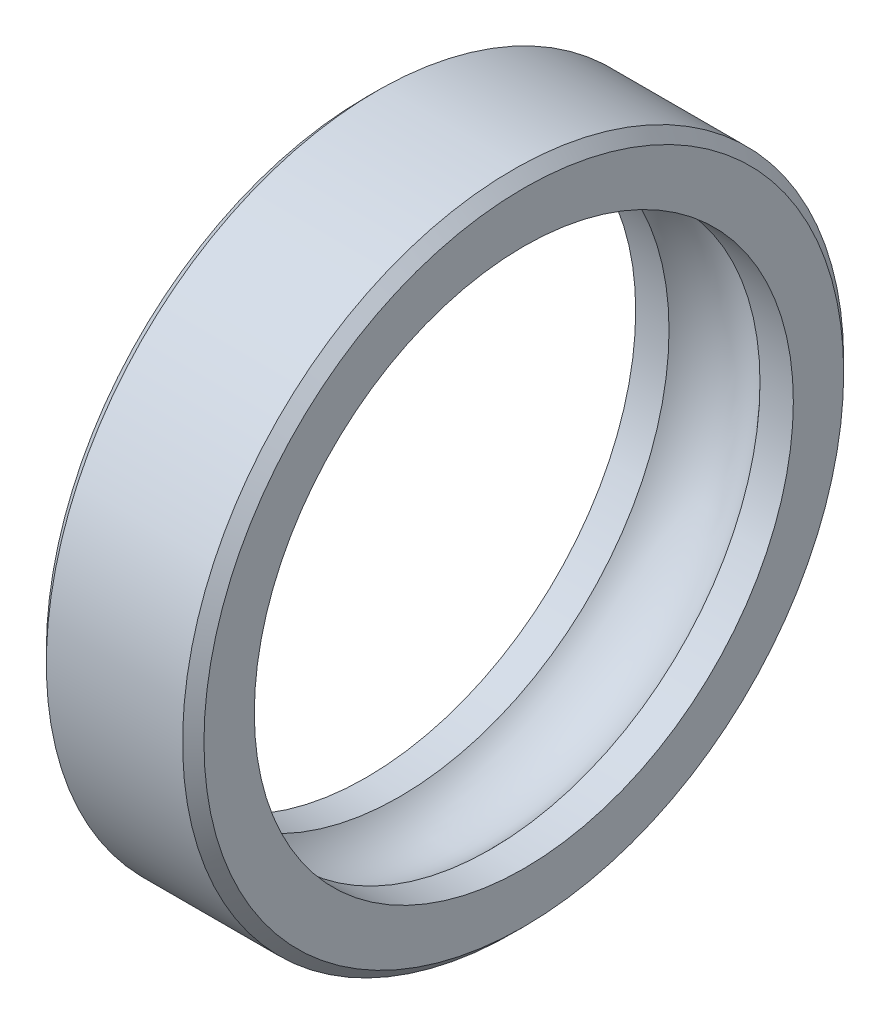
from build123d import *

# Parameters (mm, degrees)
CHAMFER1_SIZE = 2.1


with BuildPart() as part:
    # Sketch2 → Revolve1 (revolve)
    with BuildSketch(Plane.XY, mode=Mode.PRIVATE) as revolve1_sk:
        with BuildLine():
            Line((-15.5, 65), (15.5, 65))
            Line((15.5, 65), (15.5, 53))
            Line((15.5, 53), (8.94427191, 53))
            ThreePointArc((8.94427191, 53), (0, 57), (-8.94427191, 53))
            Line((-8.94427191, 53), (-15.5, 53))
            Line((-15.5, 53), (-15.5, 65))
        make_face()
    revolve(revolve1_sk.sketch.rotate(Axis((-21.584112125, 0, 0), (1, 0, 0)), 90), axis=Axis((-21.584112125, 0, 0), (1, 0, 0)))

    # Chamfer1
    chamfer1_edges = [part.edges().sort_by_distance(p)[0] for p in [
        (-15.5, 0, -65),
        (15.5, 0, -65),
    ]]
    chamfer(chamfer1_edges, length=CHAMFER1_SIZE)


solid = part.part
